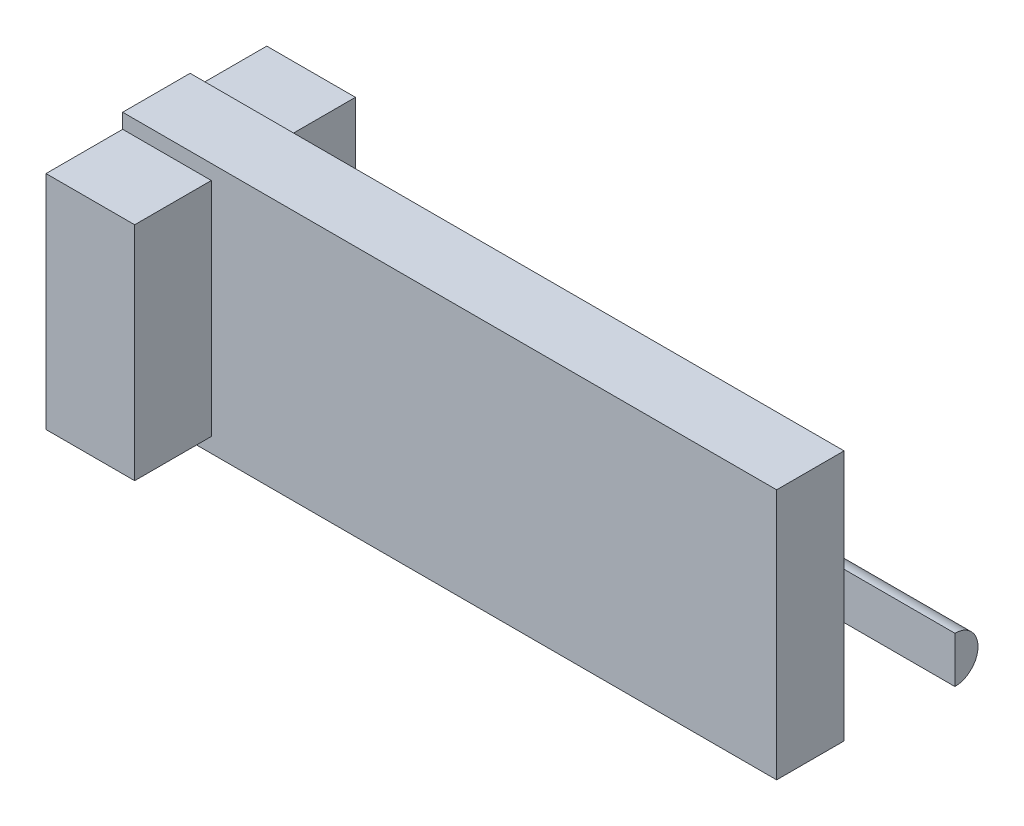
from build123d import *

# Parameters (mm, degrees)
SKETCH1_W           = 35.4
SKETCH1_H           = 13.6
BOSS_EXTRUDE1_DEPTH = 1.825
SKETCH2_W           = 4.8
SKETCH2_H           = 12
BOSS_EXTRUDE2_DEPTH = 4.15
SKETCH3_W           = 4.8
SKETCH3_H           = 12
BOSS_EXTRUDE3_DEPTH = 4.15
SKETCH4_W           = 6
SKETCH4_H           = 1.25
REVOLVE1_ANGLE      = 180


with BuildPart() as part:
    # Sketch1 → Boss-Extrude1 (new, symmetric)
    with BuildSketch(Plane.XY):
        Rectangle(SKETCH1_W, SKETCH1_H)
    extrude(amount=BOSS_EXTRUDE1_DEPTH, both=True)

    # Sketch2 → Boss-Extrude2 (add)
    with BuildSketch(Plane.XY.offset(1.825)):
        with Locations((-15.3, 0)):
            Rectangle(SKETCH2_W, SKETCH2_H)
    extrude(amount=BOSS_EXTRUDE2_DEPTH)

    # Sketch3 → Boss-Extrude3 (add)
    with BuildSketch(Plane(origin=(0, 0, -1.825), x_dir=(-1, 0, 0), z_dir=(0, 0, -1))):
        with Locations((15.3, 0)):
            Rectangle(SKETCH3_W, SKETCH3_H)
    extrude(amount=BOSS_EXTRUDE3_DEPTH)

    # Sketch4 → Revolve1 (revolve)
    with BuildSketch(Plane(origin=(0, 0, -1.825), x_dir=(-1, 0, 0), z_dir=(0, 0, -1))):
        with Locations((-20.7, 0.625)):
            Rectangle(SKETCH4_W, SKETCH4_H)
        with Locations((-14.7, 0.625)):
            Rectangle(SKETCH4_W, SKETCH4_H)
    revolve(axis=Axis((11.7, 0, -1.825), (-1, 0, 0)), revolution_arc=REVOLVE1_ANGLE)


solid = part.part
